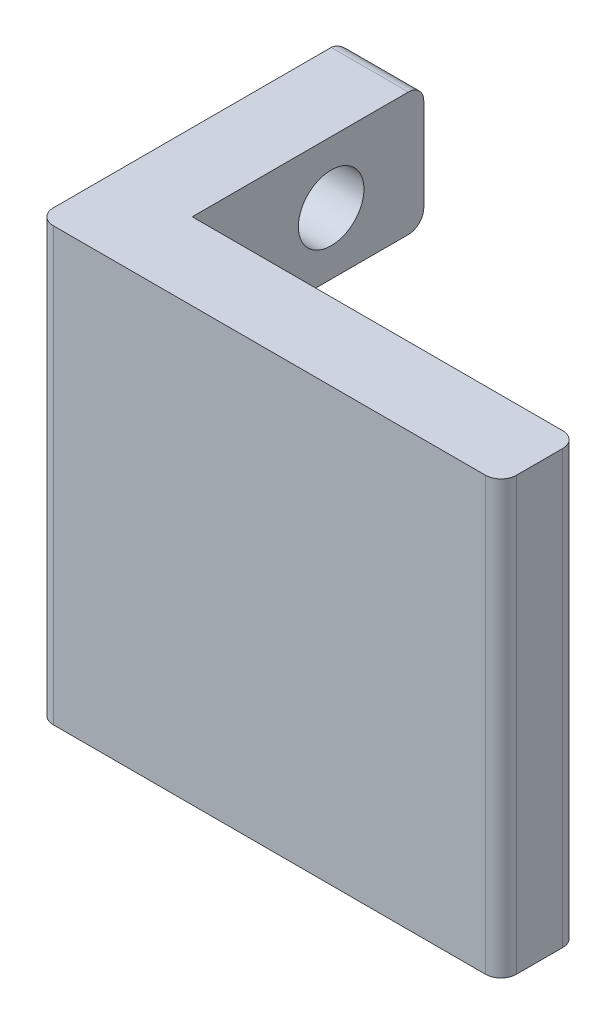
from build123d import *

# Parameters (mm, degrees)
SKETCH1_W           = 25
SKETCH1_H           = 5
BOSS_EXTRUDE1_DEPTH = 28
BOSS_EXTRUDE3_DEPTH = 5
FILLET2_R           = 1
CUT_EXTRUDE2_REACH  = 46.612
SKETCH5_R           = 2.125


with BuildPart() as part:
    # Sketch1 → Boss-Extrude1 (new body)
    with BuildSketch(Plane(origin=(0, 0, 0), x_dir=(1, 0, 0), z_dir=(0, 1, 0))):
        Rectangle(SKETCH1_W, SKETCH1_H)
    extrude(amount=BOSS_EXTRUDE1_DEPTH)

    # Sketch4 → Boss-Extrude3 (add)
    with BuildSketch(Plane.ZY.offset(12.5)):
        Polygon((-17.5, 20), (-2.5, 20), (-2.5, 8), (-17.5, 8), (-17.5, 0), (2.5, 0), (2.5, 28), (-17.5, 28), align=None)
    extrude(amount=BOSS_EXTRUDE3_DEPTH)

    # Fillet2
    fillet2_edges = [part.edges().sort_by_distance(p)[0] for p in [
        (-15, 28, -17.5),
        (-15, 20, -17.5),
        (-15, 20, -2.5),
        (-15, 8, -2.5),
        (-15, 8, -17.5),
        (-15, 0, -17.5),
        (-17.5, 14, 2.5),
        (-17.5, 24, -17.5),
        (-17.5, 20, -10),
        (-17.5, 14, -2.5),
        (-17.5, 8, -10),
        (-17.5, 4, -17.5),
        (12.5, 14, 2.5),
        (12.5, 14, -2.5),
    ]]
    fillet(fillet2_edges, radius=FILLET2_R)

    # Sketch5 → Cut-Extrude2 (cut, up to next)
    with BuildSketch(Plane.ZY.offset(17.5), mode=Mode.PRIVATE) as cut_extrude2_sk1:
        with Locations((-11.5, 24)):
            Circle(SKETCH5_R)
    cut_extrude2_tool1 = extrude(cut_extrude2_sk1.sketch, amount=-CUT_EXTRUDE2_REACH, mode=Mode.PRIVATE) & part.part
    # Sketch5 → Cut-Extrude2 (cut, up to next)
    with BuildSketch(Plane.ZY.offset(17.5), mode=Mode.PRIVATE) as cut_extrude2_sk2:
        with Locations((-11.5, 4)):
            Circle(SKETCH5_R)
    cut_extrude2_tool2 = extrude(cut_extrude2_sk2.sketch, amount=-CUT_EXTRUDE2_REACH, mode=Mode.PRIVATE) & part.part
    add(cut_extrude2_tool1.solids().sort_by_distance((-17.5, 24, -11.5))[0], mode=Mode.SUBTRACT)
    add(cut_extrude2_tool2.solids().sort_by_distance((-17.5, 4, -11.5))[0], mode=Mode.SUBTRACT)


solid = part.part
